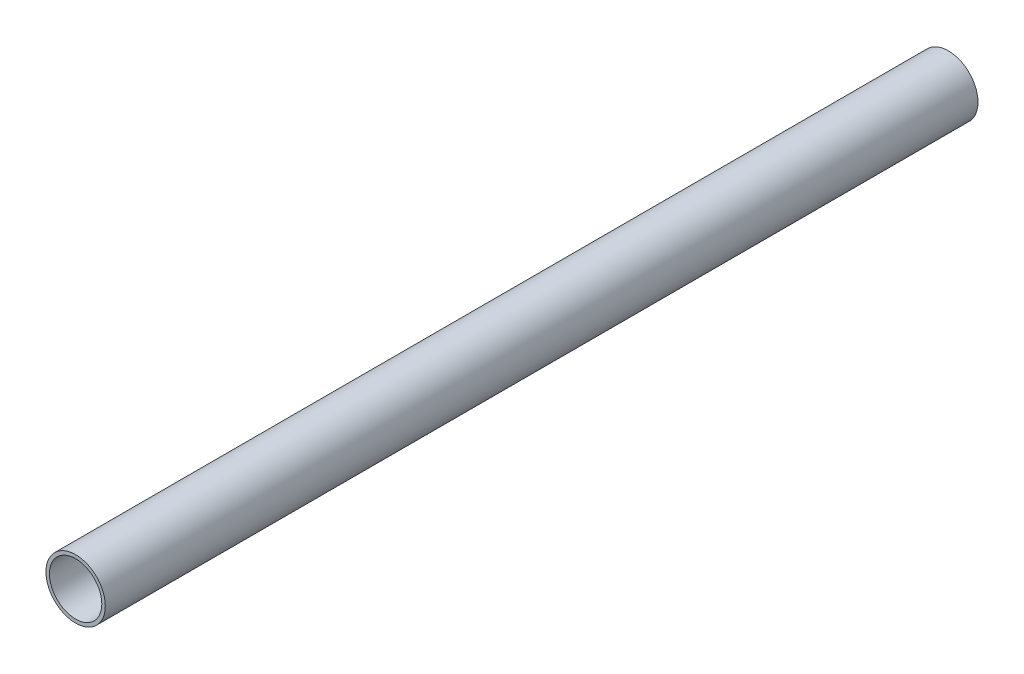
from build123d import *

# Parameters (mm, degrees)
SKETCH1_R           = 17
SKETCH1_R_2         = 15
BOSS_EXTRUDE1_DEPTH = 250


with BuildPart() as part:
    # Sketch1 → Boss-Extrude1 (new, symmetric)
    with BuildSketch(Plane.XY):
        Circle(SKETCH1_R)
        Circle(SKETCH1_R_2, mode=Mode.SUBTRACT)
    extrude(amount=BOSS_EXTRUDE1_DEPTH, both=True)


solid = part.part
